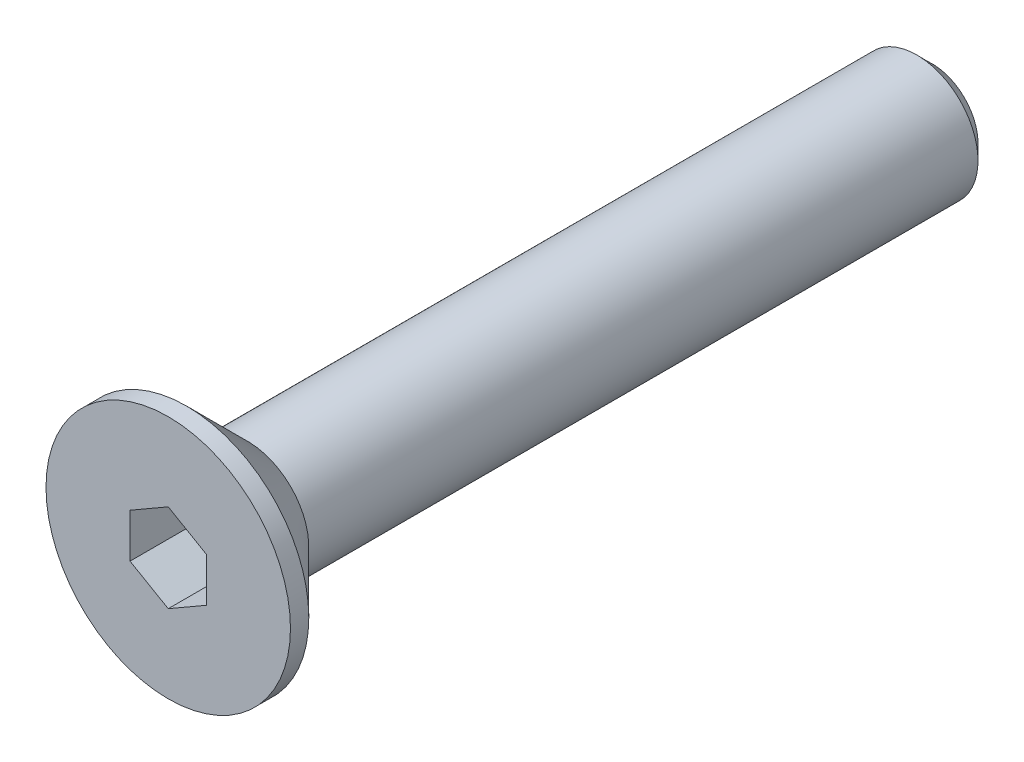
from build123d import *

# Parameters (mm, degrees)
CHAMFER_1_SIZE      = 0.5
CUT_EXTRUDE_1_DEPTH = 2.5


with BuildPart() as part:
    # 草图1 → 旋转1 (revolve)
    with BuildSketch(Plane(origin=(0, 0, 0), x_dir=(0, 0, -1), z_dir=(1, 0, 0)), mode=Mode.PRIVATE) as revolve_1_sk:
        Polygon((-12.5, 0), (-12.5, 4), (-11.9, 4), (-9.9, 2), (12.5, 2), (12.5, 0), align=None)
    revolve(revolve_1_sk.sketch.rotate(Axis((0, 0, -12.5), (0, 0, 1)), 90), axis=Axis((0, 0, -12.5), (0, 0, 1)))

    # 倒角1
    chamfer_1_edges = [part.edges().sort_by_distance(p)[0] for p in [
        (2, 0, -12.5),
    ]]
    chamfer(chamfer_1_edges, length=CHAMFER_1_SIZE)

    # 草图2 → 切除-拉伸1 (cut)
    with BuildSketch(Plane.XY.offset(12.5)):
        Polygon((0, 1.443375673), (-1.25, 0.721687836), (-1.25, -0.721687836), (0, -1.443375673), (1.25, -0.721687836), (1.25, 0.721687836), align=None)
    extrude(amount=-CUT_EXTRUDE_1_DEPTH, mode=Mode.SUBTRACT)


solid = part.part
